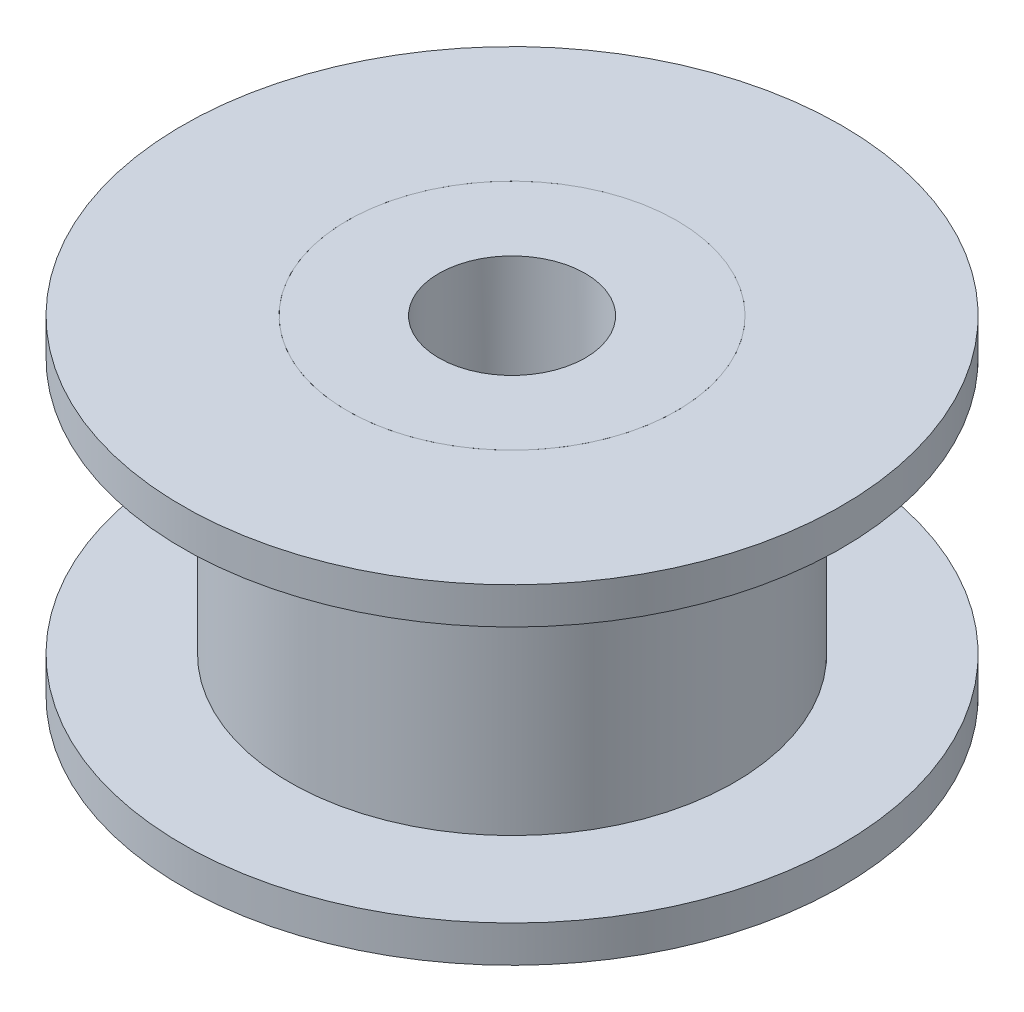
from build123d import *

# Parameters (mm, degrees)
ESQUISSE3_R        = 4.5
ESQUISSE3_R_2      = 2
BOSS_EXTRU_1_DEPTH = 3


with BuildPart() as part:
    # Esquisse2 → Révolution1 (revolve)
    with BuildSketch(Plane.XY, mode=Mode.PRIVATE) as r_volution1_sk:
        Polygon((2.5, 1.5), (4.5, 1.5), (4.5, 4.5), (9, 4.5), (9, 3.5), (6.075, 3.5), (6.075, -3.5), (9, -3.5), (9, -4.5), (4.5, -4.5), (4.5, -1.5), (2.5, -1.5), align=None)
    revolve(r_volution1_sk.sketch.rotate(Axis((0, 0, 0), (0, 1, 0)), 90), axis=Axis((0, 0, 0), (0, 1, 0)))


with BuildPart() as body_2:
    # Esquisse3 → Boss.-Extru.1 (new body)
    with BuildSketch(Plane(origin=(0, -1.5, 0), x_dir=(1, 0, 0), z_dir=(0, 1, 0))):
        with Locations(Location((0, 0, 0), (0, 0, 270))):
            Circle(ESQUISSE3_R)
        with Locations(Location((0, 0, 0), (0, 0, 270))):
            Circle(ESQUISSE3_R_2, mode=Mode.SUBTRACT)
    extrude(amount=-BOSS_EXTRU_1_DEPTH)


with BuildPart() as body_3:
    # Symétrie8: mirrored copy
    add(body_2.part.mirror(Plane.ZX))


solid = Compound([part.part, body_2.part, body_3.part])
